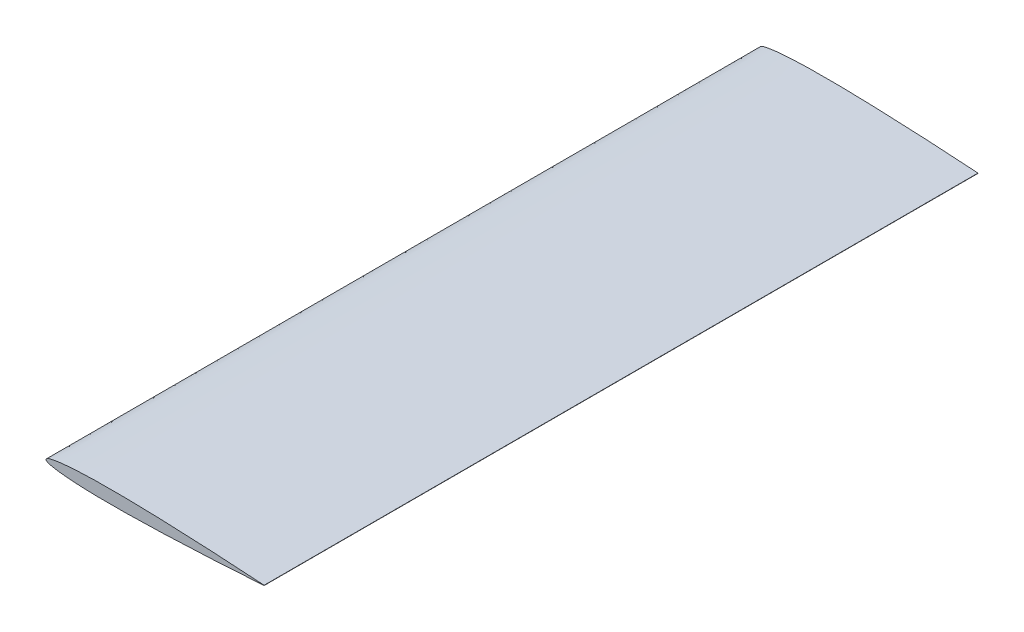
from build123d import *

# Parameters (mm, degrees)
BOSS_EXTRUDE1_DEPTH = 1371.6


with BuildPart() as part:
    # Sketch1 → Boss-Extrude1 (new body)
    with BuildSketch(Plane.XY):
        with BuildLine():
            Line((2.7617713, -8.649433762), (2.7617713, -9.177499762))
            add(Edge.make_bspline(
                [(2.7617713, -8.649433762), (-4.22285447, -8.168849499), (-18.190359469, -7.207801146), (-46.127980394, -5.420580511), (-81.050368078, -3.367838164), (-122.961215045, -1.189148193), (-164.870944955, 0.708999894), (-206.781071478, 2.253741405), (-248.69214085, 3.355364774), (-283.622437249, 3.740117536), (-311.565387623, 3.587872898), (-332.52285648, 3.17422323), (-353.491269358, 2.377110475), (-370.943152347, 1.269162711), (-384.944272294, -0.071772847), (-395.350412273, -1.336065644), (-404.420382518, -3.077303305), (-411.069295145, -4.617495195), (-419.218244094, -8.913466762), (-411.069295145, -13.209438329), (-404.420382518, -14.74963022), (-395.350412273, -16.490867881), (-384.944272294, -17.755160677), (-370.943152347, -19.096096236), (-353.491269358, -20.204043999), (-332.52285648, -21.001156754), (-311.565387623, -21.414806423), (-283.622437249, -21.567051061), (-248.69214085, -21.182298299), (-206.781071478, -20.080674929), (-164.870944955, -18.535933418), (-122.961215045, -16.637785331), (-81.050368078, -14.45909536), (-46.127980394, -12.406353014), (-18.190359469, -10.619132378), (-4.22285447, -9.658084025), (2.7617713, -9.177499762)],
                knots=[0, 0, 0, 0, 0.024924558, 0.049842883, 0.099663048, 0.149464506, 0.199249099, 0.24901648, 0.298766909, 0.348503609, 0.373371188, 0.398243493, 0.423129723, 0.448051613, 0.460542817, 0.473079728, 0.485731111, 0.492200581, 0.5, 0.507799419, 0.514268889, 0.526920272, 0.539457183, 0.551948387, 0.576870277, 0.601756507, 0.626628812, 0.651496391, 0.701233091, 0.75098352, 0.800750901, 0.850535494, 0.900336952, 0.950157117, 0.975075442, 1, 1, 1, 1], degree=3))
        make_face()
    extrude(amount=BOSS_EXTRUDE1_DEPTH)


solid = part.part
